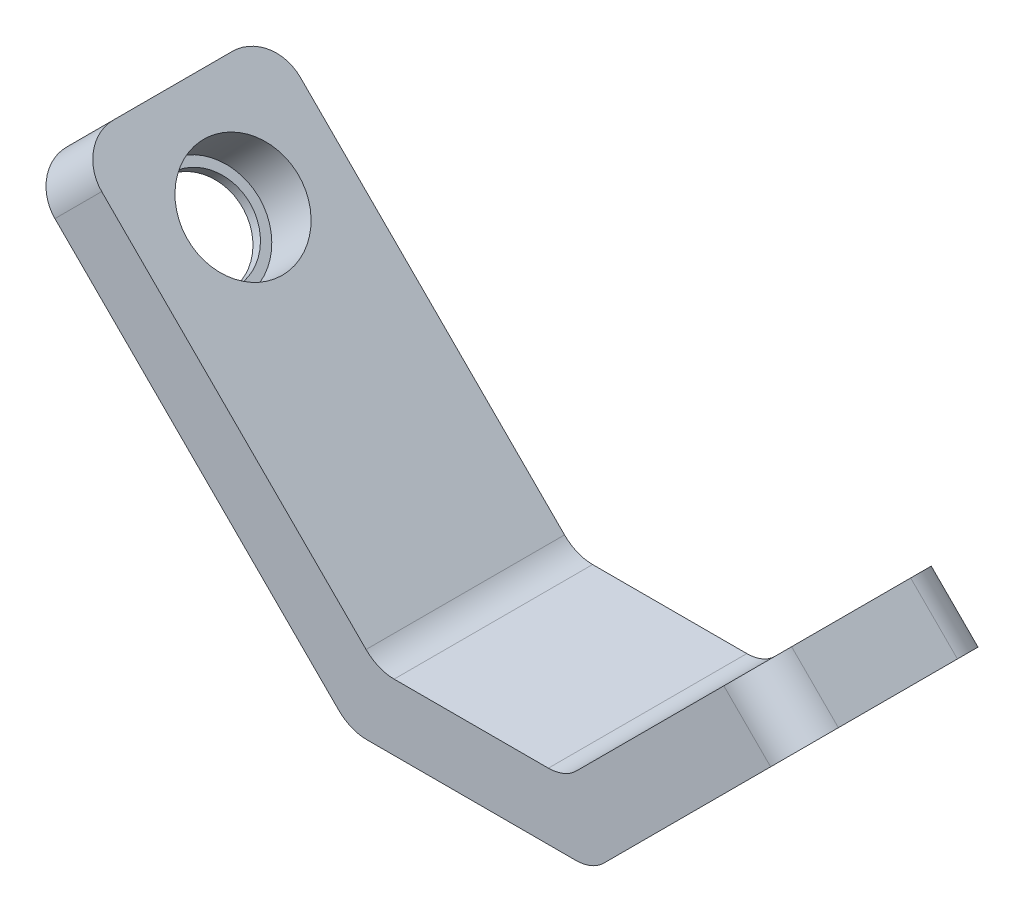
from build123d import *

# Parameters (mm, degrees)
EXTRUDE_1_DEPTH          = 7.5
CUT_EXTRUDE_1_DEPTH      = 45.584481316
CUT_EXTRUDE_1_DEPTH_BACK = 45.584481316
SKETCH_2_R               = 4.2
CUT_EXTRUDE_2_DEPTH      = 51.621141828
CUT_EXTRUDE_2_DEPTH_BACK = 51.621141828
SKETCH_3_R               = 4.2
FILLET_1_R               = 3
SKETCH_4_R               = 4.2
SKETCH_4_R_2             = 3.5
EXTRUDE_2_DEPTH          = 0.8
SKETCH_5_R               = 4.2
SKETCH_5_R_2             = 3.5
EXTRUDE_3_DEPTH          = 0.8


with BuildPart() as part:
    # ｽｹｯﾁ1 → ﾎﾞｽ - 押し出し1 (new, symmetric)
    with BuildSketch(Plane.XY):
        Polygon((0, 0), (-24.445436483, 24.445436483), (-20.909902577, 27.980970389), (2.071067812, 5), (16.213203436, 5), (30.355339059, 19.142135624), (33.890872965, 15.606601718), (18.284271247, 0), align=None)
    extrude(amount=EXTRUDE_1_DEPTH, both=True)

    # ｽｹｯﾁ2 → ｶｯﾄ - 押し出し1 (cut, two sides: drawn at the far end of the back side and taken through both)
    with BuildSketch(Plane(origin=(0, 0, 0), x_dir=(0, 0, 1), z_dir=(-0.7071067811865487, -0.7071067811865464, 0)).offset(-CUT_EXTRUDE_1_DEPTH_BACK)):
        with Locations(Location((0, 27.071067812, 0), (0, 0, 270))):
            Circle(SKETCH_2_R)
    extrude(amount=CUT_EXTRUDE_1_DEPTH + CUT_EXTRUDE_1_DEPTH_BACK, mode=Mode.SUBTRACT)

    # ｽｹｯﾁ3 → ｶｯﾄ - 押し出し2 (cut, two sides: drawn at the far end of the back side and taken through both)
    with BuildSketch(Plane(origin=(9.142135624, -9.142135624, 0), x_dir=(0, 0, -1), z_dir=(0.707106781186549, -0.7071067811865461, 0)).offset(-CUT_EXTRUDE_2_DEPTH_BACK)):
        with Locations(Location((0, 27.5, 0), (0, 0, 90))):
            Circle(SKETCH_3_R)
    extrude(amount=CUT_EXTRUDE_2_DEPTH + CUT_EXTRUDE_2_DEPTH_BACK, mode=Mode.SUBTRACT)

    # ﾌｨﾚｯﾄ1
    fillet_1_edges = [part.edges().sort_by_distance(p)[0] for p in [
        (32.123106012, 17.374368671, -7.5),
        (32.123106012, 17.374368671, 7.5),
        (0, 0, 0),
        (2.071067812, 5, 0),
        (16.213203436, 5, 0),
        (18.284271247, 0, 0),
        (-22.67766953, 26.213203436, 7.5),
        (-22.67766953, 26.213203436, -7.5),
    ]]
    fillet(fillet_1_edges, radius=FILLET_1_R)

    # ｽｹｯﾁ4 → ﾎﾞｽ - 押し出し2 (add)
    with BuildSketch(Plane(origin=(0, 0, 0), x_dir=(0, 0, -1), z_dir=(0.7071067811865475, 0.7071067811865476, 0))):
        with Locations(Location((0, 27.071067812, 0), (0, 0, 270))):
            Circle(SKETCH_4_R)
        with Locations(Location((0, 27.071067812, 0), (0, 0, 90))):
            Circle(SKETCH_4_R_2, mode=Mode.SUBTRACT)
    extrude(amount=EXTRUDE_2_DEPTH)

    # ｽｹｯﾁ5 → ﾎﾞｽ - 押し出し3 (add)
    with BuildSketch(Plane(origin=(9.142135624, -9.142135624, 0), x_dir=(0, 0, 1), z_dir=(-0.7071067811865485, 0.7071067811865467, 0))):
        with Locations(Location((0, 27.5, 0), (0, 0, 90))):
            Circle(SKETCH_5_R)
        with Locations(Location((0, 27.5, 0), (0, 0, 270))):
            Circle(SKETCH_5_R_2, mode=Mode.SUBTRACT)
    extrude(amount=EXTRUDE_3_DEPTH)


solid = part.part
